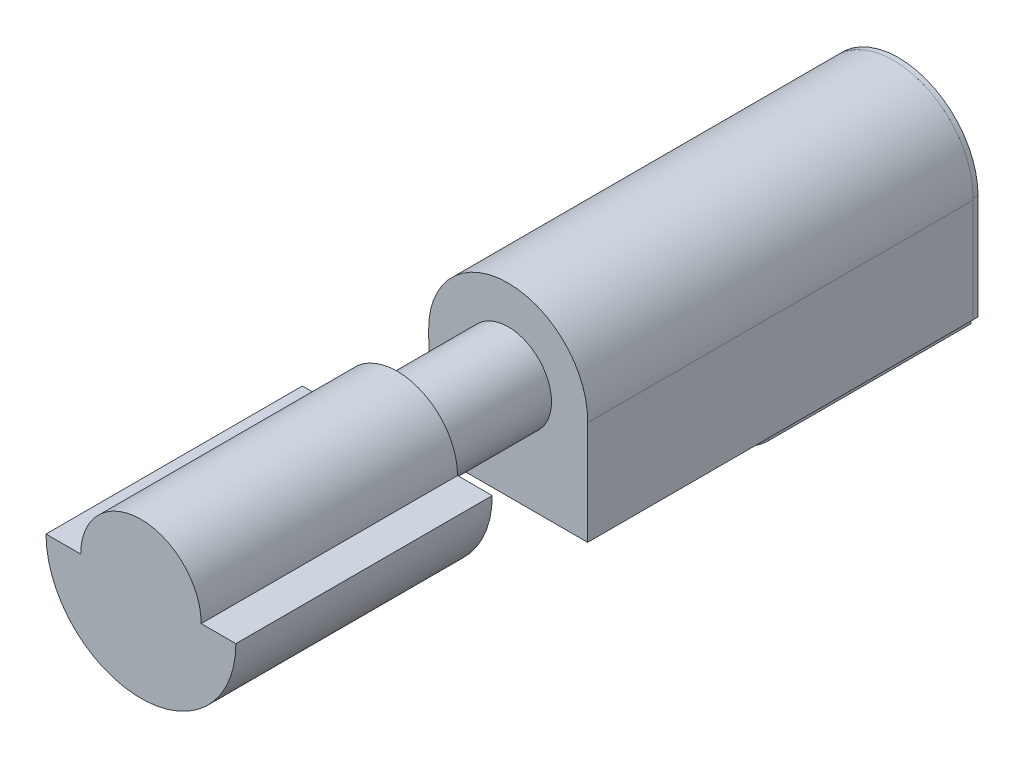
from build123d import *

# Parameters (mm, degrees)
ESQUISSE1_R             = 1.65
BOSS_EXTRU_1_DEPTH      = 8
ESQUISSE2_W             = 3.2
ESQUISSE2_H             = 2.278115777
BOSS_EXTRU_2_DEPTH      = 4.2
ESQUISSE3_R             = 0.9
BOSS_EXTRU_3_DEPTH      = 2.3
ESQUISSE4_R             = 1.97
BOSS_EXTRU_4_DEPTH      = 5.32
ENL_V_START             = -5.32
ENL_V_MAT_EXTRU_2_DEPTH = 5.32
BOSS_EXTRU_5_DEPTH      = 0.1
BOSS_EXTRU_6_DEPTH      = 8
BOSS_EXTRU_7_START      = 0.1
BOSS_EXTRU_7_DEPTH      = 0.1


with BuildPart() as part:
    # Esquisse1 → Boss.-Extru.1 (new body)
    with BuildSketch(Plane.XY):
        Circle(ESQUISSE1_R)
    extrude(amount=BOSS_EXTRU_1_DEPTH)

    # Esquisse2 → Boss.-Extru.2 (add)
    with BuildSketch(Plane(origin=(0, 0, 0), x_dir=(-1, 0, 0), z_dir=(0, 0, -1))):
        with Locations((0, -1.011435459)):
            Rectangle(ESQUISSE2_W, ESQUISSE2_H)
    extrude(amount=-BOSS_EXTRU_2_DEPTH)

    # Esquisse3 → Boss.-Extru.3 (add)
    with BuildSketch(Plane.XY.offset(8)):
        Circle(ESQUISSE3_R)
    extrude(amount=BOSS_EXTRU_3_DEPTH)

    # Esquisse4 → Boss.-Extru.4 (add)
    with BuildSketch(Plane.XY.offset(10.3)):
        Circle(ESQUISSE4_R)
    extrude(amount=BOSS_EXTRU_4_DEPTH)

    # Esquisse6 → Enlèv. mat.-Extru.2 (cut)
    with BuildSketch(Plane.XY.offset(15.62).offset(ENL_V_START)):
        with BuildLine():
            Line((-1.97, 0), (-1.25, 0))
            ThreePointArc((-1.25, 0), (0, 1.25), (1.25, 0))
            Line((1.25, 0), (1.97, 0))
            ThreePointArc((1.97, 0), (0, 1.97), (-1.97, 0))
        make_face()
    extrude(amount=ENL_V_MAT_EXTRU_2_DEPTH, mode=Mode.SUBTRACT)

    # Esquisse7 → Boss.-Extru.5 (add)
    with BuildSketch(Plane.XZ.offset(2.150493347)):
        with BuildLine():
            Line((1.6, 0), (0.3, 0))
            Line((0.3, 0), (0.3, 4.2))
            ThreePointArc((0.3, 4.2), (0.446446609, 4.553553391), (0.8, 4.7))
            Line((0.8, 4.7), (1.1, 4.7))
            ThreePointArc((1.1, 4.7), (1.453553391, 4.553553391), (1.6, 4.2))
            Line((1.6, 4.2), (1.6, 0))
        make_face()
        with BuildLine():
            Line((-1.6, 0), (-0.3, 0))
            Line((-0.3, 0), (-0.3, 4.2))
            ThreePointArc((-0.3, 4.2), (-0.446446609, 4.553553391), (-0.8, 4.7))
            Line((-0.8, 4.7), (-1.1, 4.7))
            ThreePointArc((-1.1, 4.7), (-1.453553391, 4.553553391), (-1.6, 4.2))
            Line((-1.6, 4.2), (-1.6, 0))
        make_face()
    extrude(amount=BOSS_EXTRU_5_DEPTH)

    # Esquisse8 → Boss.-Extru.6 (add)
    with BuildSketch(Plane(origin=(0, 0, 0), x_dir=(-1, 0, 0), z_dir=(0, 0, -1))):
        with BuildLine():
            Line((-1.65, 0), (-1.65, -2.150493347))
            Line((-1.65, -2.150493347), (1.6, -2.150493347))
            Line((1.6, -2.150493347), (1.61, -2.150493347))
            Line((1.61, -2.150493347), (1.65, 0))
            ThreePointArc((1.65, 0), (0, 1.686495035), (-1.65, 0))
        make_face()
    extrude(amount=-BOSS_EXTRU_6_DEPTH)

    # Esquisse9 → Boss.-Extru.7 (add)
    with BuildSketch(Plane(origin=(0, 0, 0), x_dir=(-1, 0, 0), z_dir=(0, 0, -1)).offset(BOSS_EXTRU_7_START)):
        with BuildLine():
            Line((-1.25, 0), (-1.25, -2.150493347))
            Line((-1.25, -2.150493347), (-1.65, -2.150493347))
            Line((-1.65, -2.150493347), (-1.650394869, 0.036100167))
            ThreePointArc((-1.650394869, 0.036100167), (0.018054459, 1.686697641), (1.65, 0))
            Line((1.65, 0), (1.6, -2.150493347))
            Line((1.6, -2.150493347), (1.25, -2.150493347))
            Line((1.25, -2.150493347), (1.25, 0))
            ThreePointArc((1.25, 0), (0, 1.25), (-1.25, 0))
        make_face()
    extrude(amount=-BOSS_EXTRU_7_DEPTH)


solid = part.part
